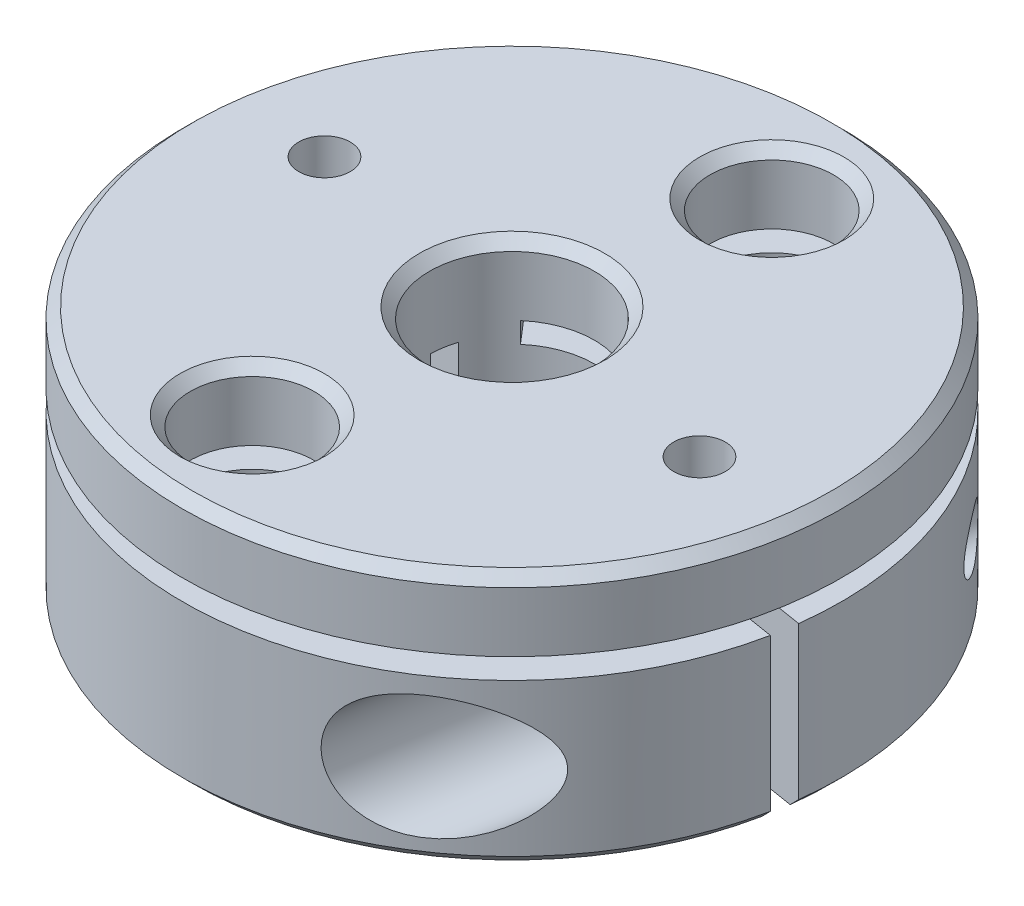
from build123d import *
from build123d.topology import SkipClean

# Parameters (mm, degrees)
SKETCH_1_R               = 16
EXTRUDE_1_DEPTH          = 12.3
CUT_EXTRUDE_START        = -4.4
CUT_EXTRUDE_1_DEPTH      = 1
CUT_EXTRUDE_START_2      = -4
CUT_EXTRUDE_2_DEPTH      = 10
EXTRUDE_2_DEPTH          = 1.2
EXTRUDE_START            = -12.3
EXTRUDE_3_DEPTH          = 12.3
CUT_EXTRUDE_START_3      = -22.2
SKETCH_6_R               = 4
CUT_EXTRUDE_3_DEPTH      = 22.2
SKETCH_7_R               = 3
CUT_EXTRUDE_4_DEPTH      = 22.2
SKETCH_8_R               = 1.25
CUT_EXTRUDE_5_DEPTH      = 22.2
CUT_EXTRUDE_6_DEPTH      = 22.2
CUT_EXTRUDE_6_DEPTH_BACK = 22.2
SKETCH_9_R               = 1.25
SKETCH_10_R              = 3
CUT_EXTRUDE_7_DEPTH      = 22.2
CHAMFER_1_SIZE           = 0.5


with BuildPart() as part:
    # 草图1 → 凸台-拉伸1 (new body)
    with BuildSketch(Plane(origin=(0, 0, 0), x_dir=(1, 0, 0), z_dir=(0, 1, 0))):
        with Locations(Location((0, 0, 0), (0, 0, 270))):
            Circle(SKETCH_1_R)
    extrude(amount=EXTRUDE_1_DEPTH)

    # 草图2 → 切除-拉伸1 (cut)
    with BuildSketch(Plane(origin=(0, 12.3, 0), x_dir=(1, 0, 0), z_dir=(0, 1, 0)).offset(CUT_EXTRUDE_START)):
        with BuildLine():
            Line((-2.614761823, 3.027048168), (-10.459047291, 12.108192671))
            ThreePointArc((-10.459047291, 12.108192671), (15.795091282, -2.552467704), (-13.74043652, -8.19758527))
            Line((-13.74043652, -8.19758527), (-3.43510913, -2.049396317))
            ThreePointArc((-3.43510913, -2.049396317), (3.948772821, -0.638116926), (-2.614761823, 3.027048168))
        make_face()
    extrude(amount=CUT_EXTRUDE_1_DEPTH, mode=Mode.SUBTRACT)

    # 草图3 → 切除-拉伸2 (cut)
    with BuildSketch(Plane(origin=(0, 12.3, 0), x_dir=(1, 0, 0), z_dir=(0, 1, 0)).offset(CUT_EXTRUDE_START_2)):
        Polygon((-22.182560076, 4.19245872), (25.665898602, -3.539794501), (25.474463524, -4.724426347), (-22.373995154, 3.007826874), align=None)
    extrude(amount=-CUT_EXTRUDE_2_DEPTH, mode=Mode.SUBTRACT)

    # 草图4 → 凸台-拉伸2 (add)
    with BuildSketch(Plane(origin=(-0.095717539, 0, 0.592315923), x_dir=(-0.9871932051548171, 0, -0.15952923147862025), z_dir=(0.15952923147862025, 0, -0.9871932051548171))):
        Polygon((15.988746042, 0), (15.988746042, 9.029422206), (5.459323837, 9.029422206), (14.488746042, 0), align=None)
    extrude(amount=EXTRUDE_2_DEPTH)

    # 草图5 → 凸台-拉伸3 (add)
    with SkipClean():  # the faces are left unmerged after this step: merging them gives an invalid solid
        with BuildSketch(Plane(origin=(0, 12.3, 0), x_dir=(1, 0, 0), z_dir=(0, 1, 0)).offset(EXTRUDE_START)):
            with BuildLine():
                Line((-15.688263913, 3.142988292), (-15.879698991, 1.958356445))
                ThreePointArc((-15.879698991, 1.958356445), (-15.795091282, 2.552467704), (-15.688263913, 3.142988292))
            make_face()
        extrude(amount=EXTRUDE_3_DEPTH)

    # 草图6 → 切除-拉伸3 (cut)
    with SkipClean():  # the faces are left unmerged after this step: merging them gives an invalid solid
        with BuildSketch(Plane(origin=(0, 12.3, 0), x_dir=(1, 0, 0), z_dir=(0, 1, 0)).offset(CUT_EXTRUDE_START_3)):
            with Locations(Location((0, 0, 0), (0, 0, 270))):
                Circle(SKETCH_6_R)
        extrude(amount=CUT_EXTRUDE_3_DEPTH, mode=Mode.SUBTRACT)

    # 草图7 → 切除-拉伸4 (cut)
    with SkipClean():  # the faces are left unmerged after this step: merging them gives an invalid solid
        with BuildSketch(Plane.XZ):
            with Locations(Location((-1.754821546, 10.859125257, 0), (0, 0, 90))):
                Circle(SKETCH_7_R)
            with Locations(Location((1.754821546, -10.859125257, 0), (0, 0, 90))):
                Circle(SKETCH_7_R)
        extrude(amount=-CUT_EXTRUDE_4_DEPTH, mode=Mode.SUBTRACT)

    # 草图8 → 切除-拉伸5 (cut)
    with SkipClean():  # the faces are left unmerged after this step: merging them gives an invalid solid
        with BuildSketch(Plane.XZ):
            with Locations(Location((-10.859125257, -1.754821546, 0), (0, 0, 217.864974212))):
                Circle(SKETCH_8_R)
            with Locations(Location((10.859125257, 1.754821546, 0), (0, 0, 90))):
                Circle(SKETCH_8_R)
        extrude(amount=-CUT_EXTRUDE_5_DEPTH, mode=Mode.SUBTRACT)

    # 草图9 → 切除-拉伸6 (cut, two sides: drawn at the far end of the back side and taken through both)
    with SkipClean():  # the faces are left unmerged after this step: merging them gives an invalid solid
        with BuildSketch(Plane(origin=(-0.095717539, 0, 0.592315923), x_dir=(-0.9871932051548171, 0, -0.15952923147862025), z_dir=(0.15952923147862025, 0, -0.9871932051548171)).offset(-CUT_EXTRUDE_6_DEPTH_BACK)):
            with Locations(Location((-11, 4.084315731, 0), (0, 0, 180))):
                Circle(SKETCH_9_R)
        extrude(amount=CUT_EXTRUDE_6_DEPTH + CUT_EXTRUDE_6_DEPTH_BACK, mode=Mode.SUBTRACT)

    # 草图10 → 切除-拉伸7 (cut)
    with SkipClean():  # the faces are left unmerged after this step: merging them gives an invalid solid
        with BuildSketch(Plane(origin=(-0.095717539, 0, 0.592315923), x_dir=(-0.9871932051548171, 0, -0.15952923147862025), z_dir=(0.15952923147862025, 0, -0.9871932051548171)).offset(CUT_EXTRUDE_START_2)):
            with Locations((-11, 4.084315731)):
                Circle(SKETCH_10_R)
        extrude(amount=-CUT_EXTRUDE_7_DEPTH, mode=Mode.SUBTRACT)

    # 倒角1
    chamfer_1_edges = [part.edges().sort_by_distance(p)[0] for p in [
        (-1.754821546, 12.3, 7.859125257),
        (-1.754821546, 0, 7.859125257),
        (1.754821546, 12.3, -13.859125257),
        (1.754821546, 0, -13.859125257),
        (-15.795091282, 0, -2.552467704),
        (-11.986110777, 12.3, 10.598733341),
        (0.638116926, 0, -3.948772821),
        (-2.842034956, 0, 2.814753508),
        (0, 12.3, -4),
    ]]
    chamfer(chamfer_1_edges, length=CHAMFER_1_SIZE)


solid = part.part
